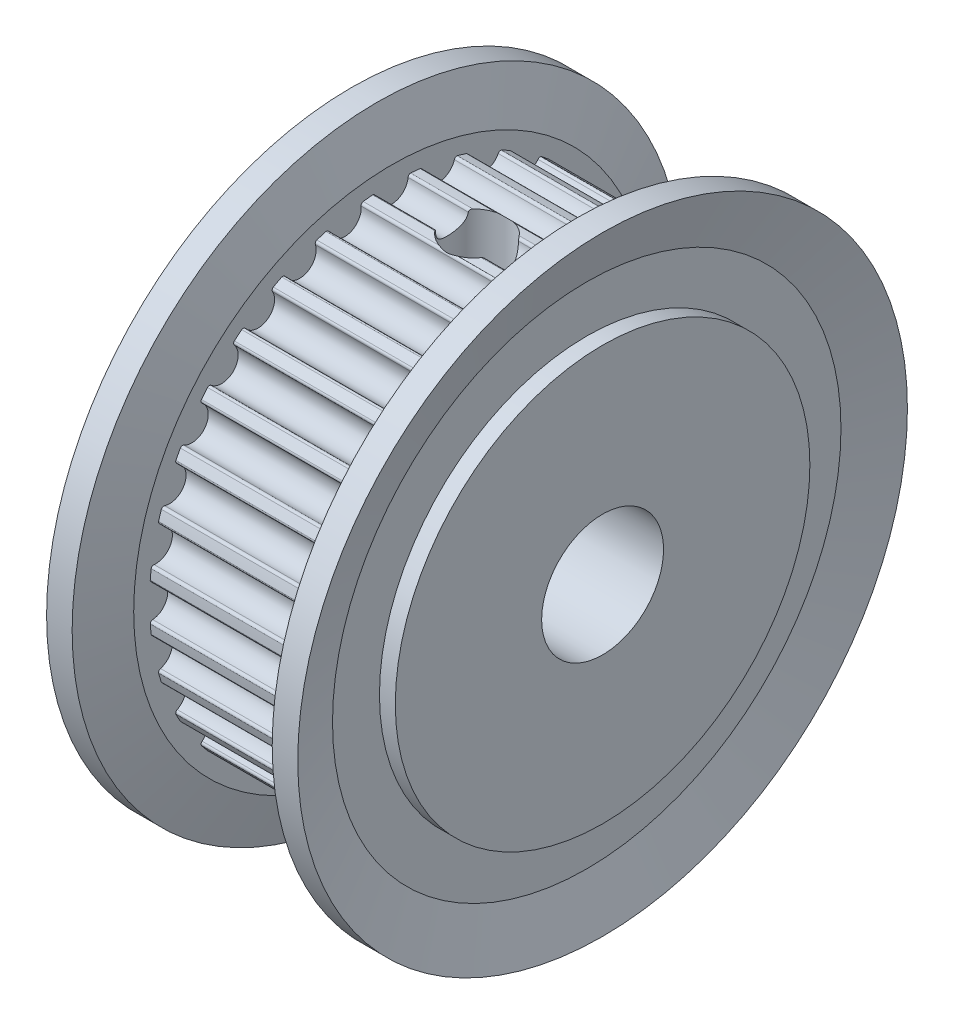
from build123d import *

# Parameters (mm, degrees)
CUT_EXTRUDE1_DEPTH       = 3.5
CUT_EXTRUDE1_DEPTH_BACK  = 3.5
CUT_EXTRUDE2_DEPTH       = 3.5
CUT_EXTRUDE2_DEPTH_BACK  = 3.5
CUT_EXTRUDE3_DEPTH       = 3.5
CUT_EXTRUDE3_DEPTH_BACK  = 3.5
CUT_EXTRUDE4_DEPTH       = 3.5
CUT_EXTRUDE4_DEPTH_BACK  = 3.5
CUT_EXTRUDE5_DEPTH       = 3.5
CUT_EXTRUDE5_DEPTH_BACK  = 3.5
CUT_EXTRUDE6_DEPTH       = 3.5
CUT_EXTRUDE6_DEPTH_BACK  = 3.5
CUT_EXTRUDE7_DEPTH       = 3.5
CUT_EXTRUDE7_DEPTH_BACK  = 3.5
CUT_EXTRUDE8_DEPTH       = 3.5
CUT_EXTRUDE8_DEPTH_BACK  = 3.5
CUT_EXTRUDE9_DEPTH       = 3.5
CUT_EXTRUDE9_DEPTH_BACK  = 3.5
CUT_EXTRUDE10_DEPTH      = 3.5
CUT_EXTRUDE10_DEPTH_BACK = 3.5
CUT_EXTRUDE11_DEPTH      = 3.5
CUT_EXTRUDE11_DEPTH_BACK = 3.5
CUT_EXTRUDE12_DEPTH      = 3.5
CUT_EXTRUDE12_DEPTH_BACK = 3.5
CUT_EXTRUDE13_DEPTH      = 3.5
CUT_EXTRUDE13_DEPTH_BACK = 3.5
CUT_EXTRUDE14_DEPTH      = 3.5
CUT_EXTRUDE14_DEPTH_BACK = 3.5
CUT_EXTRUDE15_DEPTH      = 3.5
CUT_EXTRUDE15_DEPTH_BACK = 3.5
CUT_EXTRUDE16_DEPTH      = 3.5
CUT_EXTRUDE16_DEPTH_BACK = 3.5
CUT_EXTRUDE17_DEPTH      = 3.5
CUT_EXTRUDE17_DEPTH_BACK = 3.5
CUT_EXTRUDE18_DEPTH      = 3.5
CUT_EXTRUDE18_DEPTH_BACK = 3.5
CUT_EXTRUDE19_DEPTH      = 3.5
CUT_EXTRUDE19_DEPTH_BACK = 3.5
CUT_EXTRUDE20_DEPTH      = 3.5
CUT_EXTRUDE20_DEPTH_BACK = 3.5
CUT_EXTRUDE21_DEPTH      = 3.5
CUT_EXTRUDE21_DEPTH_BACK = 3.5
CUT_EXTRUDE22_DEPTH      = 3.5
CUT_EXTRUDE22_DEPTH_BACK = 3.5
CUT_EXTRUDE23_DEPTH      = 3.5
CUT_EXTRUDE23_DEPTH_BACK = 3.5
CUT_EXTRUDE24_DEPTH      = 3.5
CUT_EXTRUDE24_DEPTH_BACK = 3.5
CUT_EXTRUDE25_DEPTH      = 3.5
CUT_EXTRUDE25_DEPTH_BACK = 3.5
CUT_EXTRUDE26_DEPTH      = 3.5
CUT_EXTRUDE26_DEPTH_BACK = 3.5
CUT_EXTRUDE27_DEPTH      = 3.5
CUT_EXTRUDE27_DEPTH_BACK = 3.5
CUT_EXTRUDE28_DEPTH      = 3.5
CUT_EXTRUDE28_DEPTH_BACK = 3.5
CUT_EXTRUDE29_DEPTH      = 3.5
CUT_EXTRUDE29_DEPTH_BACK = 3.5
CUT_EXTRUDE30_DEPTH      = 3.5
CUT_EXTRUDE30_DEPTH_BACK = 3.5
CUT_EXTRUDE31_DEPTH      = 3.5
CUT_EXTRUDE31_DEPTH_BACK = 3.5
CUT_EXTRUDE32_DEPTH      = 3.5
CUT_EXTRUDE32_DEPTH_BACK = 3.5
SKETCH36_W               = 10.3
SKETCH36_H               = 2.5
SKETCH37_W               = 1.2295
SKETCH37_H               = 9.93


with BuildPart() as part:
    # Sketch1 → Revolve1 (revolve)
    with BuildSketch(Plane.XY, mode=Mode.PRIVATE) as revolve1_sk:
        Polygon((-5.15, 0), (-5.15, 8.5), (-3.5, 8.5), (-3.5, 9.93), (3.5, 9.93), (3.5, 8.5), (5.15, 8.5), (5.15, 0), align=None)
    revolve(revolve1_sk.sketch.rotate(Axis((5.15, 0, 0), (-1, 0, 0)), 270), axis=Axis((5.15, 0, 0), (-1, 0, 0)))

    # Sketch2 → Cut-Extrude1 (cut, two sides: drawn at the far end of the back side and taken through both)
    with BuildSketch(Plane(origin=(0, 0, 0), x_dir=(0, 0, -1), z_dir=(1, 0, 0)).offset(-CUT_EXTRUDE1_DEPTH_BACK)):
        with BuildLine():
            Line((-0.950908352, 10.140512724), (-0.927279331, 9.888532197))
            Line((-0.927279331, 9.888532197), (-0.792969158, 9.89929093))
            ThreePointArc((-0.792969158, 9.89929093), (-0.711706778, 9.873169891), (-0.672449407, 9.797375816))
            ThreePointArc((-0.672449407, 9.797375816), (-2e-09, 9.181), (0.672449407, 9.797375812))
            ThreePointArc((0.672449407, 9.797375812), (0.711706777, 9.87316989), (0.792969158, 9.89929093))
            Line((0.792969158, 9.89929093), (0.927279331, 9.888532197))
            Line((0.927279331, 9.888532197), (0.950908352, 10.140512724))
            ThreePointArc((0.950908352, 10.140512724), (0, 10.185), (-0.950908352, 10.140512724))
        make_face()
    extrude(amount=CUT_EXTRUDE1_DEPTH + CUT_EXTRUDE1_DEPTH_BACK, mode=Mode.SUBTRACT)

    # Sketch3 → Cut-Extrude2 (cut, two sides: drawn at the far end of the back side and taken through both)
    with BuildSketch(Plane(origin=(0, 0, 0), x_dir=(0, 0, -1), z_dir=(1, 0, 0)).offset(-CUT_EXTRUDE2_DEPTH_BACK)):
        with BuildLine():
            Line((-2.910952807, 9.760152599), (-2.838618849, 9.5176236))
            Line((-2.838618849, 9.5176236), (-2.708988333, 9.554378222))
            ThreePointArc((-2.708988333, 9.554378222), (-2.624191426, 9.544612596), (-2.570901683, 9.477933616))
            ThreePointArc((-2.570901683, 9.477933616), (-1.791124249, 9.004589659), (-1.251844722, 9.740310354))
            ThreePointArc((-1.251844722, 9.740310354), (-1.228128363, 9.822306803), (-1.153523377, 9.863779439))
            Line((-1.153523377, 9.863779439), (-1.019695012, 9.879430047))
            Line((-1.019695012, 9.879430047), (-1.045678978, 10.131178632))
            ThreePointArc((-1.045678978, 10.131178632), (-1.98699493, 9.989298081), (-2.910952807, 9.760152599))
        make_face()
    extrude(amount=CUT_EXTRUDE2_DEPTH + CUT_EXTRUDE2_DEPTH_BACK, mode=Mode.SUBTRACT)

    # Sketch4 → Cut-Extrude3 (cut, two sides: drawn at the far end of the back side and taken through both)
    with BuildSketch(Plane(origin=(0, 0, 0), x_dir=(0, 0, -1), z_dir=(1, 0, 0)).offset(-CUT_EXTRUDE3_DEPTH_BACK)):
        with BuildLine():
            Line((-4.759130979, 9.004715283), (-4.640871837, 8.780958066))
            Line((-4.640871837, 8.780958066), (-4.520902606, 8.842296117))
            ThreePointArc((-4.520902606, 8.842296117), (-4.435829868, 8.849261191), (-4.370555649, 8.794259742))
            ThreePointArc((-4.370555649, 8.794259742), (-3.513416595, 8.482137987), (-3.12803116, 9.308930232))
            ThreePointArc((-3.12803116, 9.308930232), (-3.120767218, 9.393977974), (-3.055686656, 9.449208436))
            Line((-3.055686656, 9.449208436), (-2.927483047, 9.490666941))
            Line((-2.927483047, 9.490666941), (-3.002081451, 9.732509027))
            ThreePointArc((-3.002081451, 9.732509027), (-3.897630759, 9.409713039), (-4.759130979, 9.004715283))
        make_face()
    extrude(amount=CUT_EXTRUDE3_DEPTH + CUT_EXTRUDE3_DEPTH_BACK, mode=Mode.SUBTRACT)

    # Sketch5 → Cut-Extrude4 (cut, two sides: drawn at the far end of the back side and taken through both)
    with BuildSketch(Plane(origin=(0, 0, 0), x_dir=(0, 0, -1), z_dir=(1, 0, 0)).offset(-CUT_EXTRUDE4_DEPTH_BACK)):
        with BuildLine():
            Line((-6.424418416, 7.903231808), (-6.264778723, 7.706845238))
            Line((-6.264778723, 7.706845238), (-6.159081127, 7.790409532))
            ThreePointArc((-6.159081127, 7.790409532), (-6.077001856, 7.813837641), (-6.002251613, 7.772627398))
            ThreePointArc((-6.002251613, 7.772627398), (-5.100690311, 7.633722509), (-4.884009115, 8.519813141))
            ThreePointArc((-4.884009115, 8.519813141), (-4.893476739, 8.60464384), (-4.84042161, 8.671509651))
            Line((-4.84042161, 8.671509651), (-4.722769551, 8.737182826))
            Line((-4.722769551, 8.737182826), (-4.843115618, 8.959824558))
            ThreePointArc((-4.843115618, 8.959824558), (-5.658482823, 8.468518001), (-6.424418416, 7.903231808))
        make_face()
    extrude(amount=CUT_EXTRUDE4_DEPTH + CUT_EXTRUDE4_DEPTH_BACK, mode=Mode.SUBTRACT)

    # Sketch6 → Cut-Extrude5 (cut, two sides: drawn at the far end of the back side and taken through both)
    with BuildSketch(Plane(origin=(0, 0, 0), x_dir=(0, 0, -1), z_dir=(1, 0, 0)).offset(-CUT_EXTRUDE5_DEPTH_BACK)):
        with BuildLine():
            Line((-7.842819056, 6.498031568), (-7.647933676, 6.33656267))
            Line((-7.647933676, 6.33656267), (-7.560569614, 6.439141876))
            ThreePointArc((-7.560569614, 6.439141876), (-7.484638071, 6.478132693), (-7.403284413, 6.452297342))
            ThreePointArc((-7.403284413, 6.452297342), (-6.49194736, 6.491947357), (-6.452297339, 7.40328441))
            ThreePointArc((-6.452297339, 7.40328441), (-6.478132693, 7.484638069), (-6.439141876, 7.560569614))
            Line((-6.439141876, 7.560569614), (-6.33656267, 7.647933676))
            Line((-6.33656267, 7.647933676), (-6.498031568, 7.842819056))
            ThreePointArc((-6.498031568, 7.842819056), (-7.201882566, 7.201882566), (-7.842819056, 6.498031568))
        make_face()
    extrude(amount=CUT_EXTRUDE5_DEPTH + CUT_EXTRUDE5_DEPTH_BACK, mode=Mode.SUBTRACT)

    # Sketch7 → Cut-Extrude6 (cut, two sides: drawn at the far end of the back side and taken through both)
    with BuildSketch(Plane(origin=(0, 0, 0), x_dir=(0, 0, -1), z_dir=(1, 0, 0)).offset(-CUT_EXTRUDE6_DEPTH_BACK)):
        with BuildLine():
            Line((-8.959824558, 4.843115618), (-8.737182826, 4.722769551))
            Line((-8.737182826, 4.722769551), (-8.671509651, 4.84042161))
            ThreePointArc((-8.671509651, 4.84042161), (-8.604643842, 4.893476738), (-8.519813145, 4.884009117))
            ThreePointArc((-8.519813145, 4.884009117), (-7.633722512, 5.100690308), (-7.772627394, 6.00225161))
            ThreePointArc((-7.772627394, 6.00225161), (-7.813837641, 6.077001854), (-7.790409532, 6.159081127))
            Line((-7.790409532, 6.159081127), (-7.706845238, 6.264778723))
            Line((-7.706845238, 6.264778723), (-7.903231808, 6.424418416))
            ThreePointArc((-7.903231808, 6.424418416), (-8.468518001, 5.658482823), (-8.959824558, 4.843115618))
        make_face()
    extrude(amount=CUT_EXTRUDE6_DEPTH + CUT_EXTRUDE6_DEPTH_BACK, mode=Mode.SUBTRACT)

    # Sketch8 → Cut-Extrude7 (cut, two sides: drawn at the far end of the back side and taken through both)
    with BuildSketch(Plane(origin=(0, 0, 0), x_dir=(0, 0, -1), z_dir=(1, 0, 0)).offset(-CUT_EXTRUDE7_DEPTH_BACK)):
        with BuildLine():
            Line((-9.732509027, 3.002081451), (-9.490666941, 2.927483047))
            Line((-9.490666941, 2.927483047), (-9.449208436, 3.055686656))
            ThreePointArc((-9.449208436, 3.055686656), (-9.393977976, 3.120767217), (-9.308930236, 3.128031162))
            ThreePointArc((-9.308930236, 3.128031162), (-8.482137989, 3.513416591), (-8.794259738, 4.370555647))
            ThreePointArc((-8.794259738, 4.370555647), (-8.84926119, 4.435829866), (-8.842296117, 4.520902606))
            Line((-8.842296117, 4.520902606), (-8.780958066, 4.640871837))
            Line((-8.780958066, 4.640871837), (-9.004715283, 4.759130979))
            ThreePointArc((-9.004715283, 4.759130979), (-9.409713039, 3.897630759), (-9.732509027, 3.002081451))
        make_face()
    extrude(amount=CUT_EXTRUDE7_DEPTH + CUT_EXTRUDE7_DEPTH_BACK, mode=Mode.SUBTRACT)

    # Sketch9 → Cut-Extrude8 (cut, two sides: drawn at the far end of the back side and taken through both)
    with BuildSketch(Plane(origin=(0, 0, 0), x_dir=(0, 0, -1), z_dir=(1, 0, 0)).offset(-CUT_EXTRUDE8_DEPTH_BACK)):
        with BuildLine():
            Line((-10.131178632, 1.045678978), (-9.879430047, 1.019695012))
            Line((-9.879430047, 1.019695012), (-9.863779439, 1.153523377))
            ThreePointArc((-9.863779439, 1.153523377), (-9.822306805, 1.228128361), (-9.740310358, 1.251844723))
            ThreePointArc((-9.740310358, 1.251844723), (-9.00458966, 1.791124244), (-9.477933611, 2.570901682))
            ThreePointArc((-9.477933611, 2.570901682), (-9.544612594, 2.624191424), (-9.554378222, 2.708988333))
            Line((-9.554378222, 2.708988333), (-9.5176236, 2.838618849))
            Line((-9.5176236, 2.838618849), (-9.760152599, 2.910952807))
            ThreePointArc((-9.760152599, 2.910952807), (-9.989298081, 1.98699493), (-10.131178632, 1.045678978))
        make_face()
    extrude(amount=CUT_EXTRUDE8_DEPTH + CUT_EXTRUDE8_DEPTH_BACK, mode=Mode.SUBTRACT)

    # Sketch10 → Cut-Extrude9 (cut, two sides: drawn at the far end of the back side and taken through both)
    with BuildSketch(Plane(origin=(0, 0, 0), x_dir=(0, 0, -1), z_dir=(1, 0, 0)).offset(-CUT_EXTRUDE9_DEPTH_BACK)):
        with BuildLine():
            Line((-10.140512724, -0.950908352), (-9.888532197, -0.927279331))
            Line((-9.888532197, -0.927279331), (-9.89929093, -0.792969158))
            ThreePointArc((-9.89929093, -0.792969158), (-9.873169891, -0.711706778), (-9.797375816, -0.672449407))
            ThreePointArc((-9.797375816, -0.672449407), (-9.181, -2e-09), (-9.797375812, 0.672449407))
            ThreePointArc((-9.797375812, 0.672449407), (-9.87316989, 0.711706777), (-9.89929093, 0.792969158))
            Line((-9.89929093, 0.792969158), (-9.888532197, 0.927279331))
            Line((-9.888532197, 0.927279331), (-10.140512724, 0.950908352))
            ThreePointArc((-10.140512724, 0.950908352), (-10.185, 0), (-10.140512724, -0.950908352))
        make_face()
    extrude(amount=CUT_EXTRUDE9_DEPTH + CUT_EXTRUDE9_DEPTH_BACK, mode=Mode.SUBTRACT)

    # Sketch11 → Cut-Extrude10 (cut, two sides: drawn at the far end of the back side and taken through both)
    with BuildSketch(Plane(origin=(0, 0, 0), x_dir=(0, 0, -1), z_dir=(1, 0, 0)).offset(-CUT_EXTRUDE10_DEPTH_BACK)):
        with BuildLine():
            Line((-9.760152599, -2.910952807), (-9.5176236, -2.838618849))
            Line((-9.5176236, -2.838618849), (-9.554378222, -2.708988333))
            ThreePointArc((-9.554378222, -2.708988333), (-9.544612596, -2.624191426), (-9.477933616, -2.570901683))
            ThreePointArc((-9.477933616, -2.570901683), (-9.004589659, -1.791124249), (-9.740310354, -1.251844722))
            ThreePointArc((-9.740310354, -1.251844722), (-9.822306803, -1.228128363), (-9.863779439, -1.153523377))
            Line((-9.863779439, -1.153523377), (-9.879430047, -1.019695012))
            Line((-9.879430047, -1.019695012), (-10.131178632, -1.045678978))
            ThreePointArc((-10.131178632, -1.045678978), (-9.989298081, -1.98699493), (-9.760152599, -2.910952807))
        make_face()
    extrude(amount=CUT_EXTRUDE10_DEPTH + CUT_EXTRUDE10_DEPTH_BACK, mode=Mode.SUBTRACT)

    # Sketch12 → Cut-Extrude11 (cut, two sides: drawn at the far end of the back side and taken through both)
    with BuildSketch(Plane(origin=(0, 0, 0), x_dir=(0, 0, -1), z_dir=(1, 0, 0)).offset(-CUT_EXTRUDE11_DEPTH_BACK)):
        with BuildLine():
            Line((-9.004715283, -4.759130979), (-8.780958066, -4.640871837))
            Line((-8.780958066, -4.640871837), (-8.842296117, -4.520902606))
            ThreePointArc((-8.842296117, -4.520902606), (-8.849261191, -4.435829868), (-8.794259742, -4.370555649))
            ThreePointArc((-8.794259742, -4.370555649), (-8.482137987, -3.513416595), (-9.308930232, -3.12803116))
            ThreePointArc((-9.308930232, -3.12803116), (-9.393977974, -3.120767218), (-9.449208436, -3.055686656))
            Line((-9.449208436, -3.055686656), (-9.490666941, -2.927483047))
            Line((-9.490666941, -2.927483047), (-9.732509027, -3.002081451))
            ThreePointArc((-9.732509027, -3.002081451), (-9.409713039, -3.897630759), (-9.004715283, -4.759130979))
        make_face()
    extrude(amount=CUT_EXTRUDE11_DEPTH + CUT_EXTRUDE11_DEPTH_BACK, mode=Mode.SUBTRACT)

    # Sketch13 → Cut-Extrude12 (cut, two sides: drawn at the far end of the back side and taken through both)
    with BuildSketch(Plane(origin=(0, 0, 0), x_dir=(0, 0, -1), z_dir=(1, 0, 0)).offset(-CUT_EXTRUDE12_DEPTH_BACK)):
        with BuildLine():
            Line((-7.903231808, -6.424418416), (-7.706845238, -6.264778723))
            Line((-7.706845238, -6.264778723), (-7.790409532, -6.159081127))
            ThreePointArc((-7.790409532, -6.159081127), (-7.813837641, -6.077001856), (-7.772627398, -6.002251613))
            ThreePointArc((-7.772627398, -6.002251613), (-7.633722509, -5.100690311), (-8.519813141, -4.884009115))
            ThreePointArc((-8.519813141, -4.884009115), (-8.60464384, -4.893476739), (-8.671509651, -4.84042161))
            Line((-8.671509651, -4.84042161), (-8.737182826, -4.722769551))
            Line((-8.737182826, -4.722769551), (-8.959824558, -4.843115618))
            ThreePointArc((-8.959824558, -4.843115618), (-8.468518001, -5.658482823), (-7.903231808, -6.424418416))
        make_face()
    extrude(amount=CUT_EXTRUDE12_DEPTH + CUT_EXTRUDE12_DEPTH_BACK, mode=Mode.SUBTRACT)

    # Sketch14 → Cut-Extrude13 (cut, two sides: drawn at the far end of the back side and taken through both)
    with BuildSketch(Plane(origin=(0, 0, 0), x_dir=(0, 0, -1), z_dir=(1, 0, 0)).offset(-CUT_EXTRUDE13_DEPTH_BACK)):
        with BuildLine():
            Line((-6.498031568, -7.842819056), (-6.33656267, -7.647933676))
            Line((-6.33656267, -7.647933676), (-6.439141876, -7.560569614))
            ThreePointArc((-6.439141876, -7.560569614), (-6.478132693, -7.484638071), (-6.452297342, -7.403284413))
            ThreePointArc((-6.452297342, -7.403284413), (-6.491947357, -6.49194736), (-7.40328441, -6.452297339))
            ThreePointArc((-7.40328441, -6.452297339), (-7.484638069, -6.478132693), (-7.560569614, -6.439141876))
            Line((-7.560569614, -6.439141876), (-7.647933676, -6.33656267))
            Line((-7.647933676, -6.33656267), (-7.842819056, -6.498031568))
            ThreePointArc((-7.842819056, -6.498031568), (-7.201882566, -7.201882566), (-6.498031568, -7.842819056))
        make_face()
    extrude(amount=CUT_EXTRUDE13_DEPTH + CUT_EXTRUDE13_DEPTH_BACK, mode=Mode.SUBTRACT)

    # Sketch15 → Cut-Extrude14 (cut, two sides: drawn at the far end of the back side and taken through both)
    with BuildSketch(Plane(origin=(0, 0, 0), x_dir=(0, 0, -1), z_dir=(1, 0, 0)).offset(-CUT_EXTRUDE14_DEPTH_BACK)):
        with BuildLine():
            Line((-4.843115618, -8.959824558), (-4.722769551, -8.737182826))
            Line((-4.722769551, -8.737182826), (-4.84042161, -8.671509651))
            ThreePointArc((-4.84042161, -8.671509651), (-4.893476738, -8.604643842), (-4.884009117, -8.519813145))
            ThreePointArc((-4.884009117, -8.519813145), (-5.100690308, -7.633722512), (-6.00225161, -7.772627394))
            ThreePointArc((-6.00225161, -7.772627394), (-6.077001854, -7.813837641), (-6.159081127, -7.790409532))
            Line((-6.159081127, -7.790409532), (-6.264778723, -7.706845238))
            Line((-6.264778723, -7.706845238), (-6.424418416, -7.903231808))
            ThreePointArc((-6.424418416, -7.903231808), (-5.658482823, -8.468518001), (-4.843115618, -8.959824558))
        make_face()
    extrude(amount=CUT_EXTRUDE14_DEPTH + CUT_EXTRUDE14_DEPTH_BACK, mode=Mode.SUBTRACT)

    # Sketch16 → Cut-Extrude15 (cut, two sides: drawn at the far end of the back side and taken through both)
    with BuildSketch(Plane(origin=(0, 0, 0), x_dir=(0, 0, -1), z_dir=(1, 0, 0)).offset(-CUT_EXTRUDE15_DEPTH_BACK)):
        with BuildLine():
            Line((-3.002081451, -9.732509027), (-2.927483047, -9.490666941))
            Line((-2.927483047, -9.490666941), (-3.055686656, -9.449208436))
            ThreePointArc((-3.055686656, -9.449208436), (-3.120767217, -9.393977976), (-3.128031162, -9.308930236))
            ThreePointArc((-3.128031162, -9.308930236), (-3.513416591, -8.482137989), (-4.370555647, -8.794259738))
            ThreePointArc((-4.370555647, -8.794259738), (-4.435829866, -8.84926119), (-4.520902606, -8.842296117))
            Line((-4.520902606, -8.842296117), (-4.640871837, -8.780958066))
            Line((-4.640871837, -8.780958066), (-4.759130979, -9.004715283))
            ThreePointArc((-4.759130979, -9.004715283), (-3.897630759, -9.409713039), (-3.002081451, -9.732509027))
        make_face()
    extrude(amount=CUT_EXTRUDE15_DEPTH + CUT_EXTRUDE15_DEPTH_BACK, mode=Mode.SUBTRACT)

    # Sketch17 → Cut-Extrude16 (cut, two sides: drawn at the far end of the back side and taken through both)
    with BuildSketch(Plane(origin=(0, 0, 0), x_dir=(0, 0, -1), z_dir=(1, 0, 0)).offset(-CUT_EXTRUDE16_DEPTH_BACK)):
        with BuildLine():
            Line((-1.045678978, -10.131178632), (-1.019695012, -9.879430047))
            Line((-1.019695012, -9.879430047), (-1.153523377, -9.863779439))
            ThreePointArc((-1.153523377, -9.863779439), (-1.228128361, -9.822306805), (-1.251844723, -9.740310358))
            ThreePointArc((-1.251844723, -9.740310358), (-1.791124244, -9.00458966), (-2.570901682, -9.477933611))
            ThreePointArc((-2.570901682, -9.477933611), (-2.624191424, -9.544612594), (-2.708988333, -9.554378222))
            Line((-2.708988333, -9.554378222), (-2.838618849, -9.5176236))
            Line((-2.838618849, -9.5176236), (-2.910952807, -9.760152599))
            ThreePointArc((-2.910952807, -9.760152599), (-1.98699493, -9.989298081), (-1.045678978, -10.131178632))
        make_face()
    extrude(amount=CUT_EXTRUDE16_DEPTH + CUT_EXTRUDE16_DEPTH_BACK, mode=Mode.SUBTRACT)

    # Sketch18 → Cut-Extrude17 (cut, two sides: drawn at the far end of the back side and taken through both)
    with BuildSketch(Plane(origin=(0, 0, 0), x_dir=(0, 0, -1), z_dir=(1, 0, 0)).offset(-CUT_EXTRUDE17_DEPTH_BACK)):
        with BuildLine():
            Line((0.950908352, -10.140512724), (0.927279331, -9.888532197))
            Line((0.927279331, -9.888532197), (0.792969158, -9.89929093))
            ThreePointArc((0.792969158, -9.89929093), (0.711706778, -9.873169891), (0.672449407, -9.797375816))
            ThreePointArc((0.672449407, -9.797375816), (2e-09, -9.181), (-0.672449407, -9.797375812))
            ThreePointArc((-0.672449407, -9.797375812), (-0.711706777, -9.87316989), (-0.792969158, -9.89929093))
            Line((-0.792969158, -9.89929093), (-0.927279331, -9.888532197))
            Line((-0.927279331, -9.888532197), (-0.950908352, -10.140512724))
            ThreePointArc((-0.950908352, -10.140512724), (0, -10.185), (0.950908352, -10.140512724))
        make_face()
    extrude(amount=CUT_EXTRUDE17_DEPTH + CUT_EXTRUDE17_DEPTH_BACK, mode=Mode.SUBTRACT)

    # Sketch19 → Cut-Extrude18 (cut, two sides: drawn at the far end of the back side and taken through both)
    with BuildSketch(Plane(origin=(0, 0, 0), x_dir=(0, 0, -1), z_dir=(1, 0, 0)).offset(-CUT_EXTRUDE18_DEPTH_BACK)):
        with BuildLine():
            Line((2.910952807, -9.760152599), (2.838618849, -9.5176236))
            Line((2.838618849, -9.5176236), (2.708988333, -9.554378222))
            ThreePointArc((2.708988333, -9.554378222), (2.624191426, -9.544612596), (2.570901683, -9.477933616))
            ThreePointArc((2.570901683, -9.477933616), (1.791124249, -9.004589659), (1.251844722, -9.740310354))
            ThreePointArc((1.251844722, -9.740310354), (1.228128363, -9.822306803), (1.153523377, -9.863779439))
            Line((1.153523377, -9.863779439), (1.019695012, -9.879430047))
            Line((1.019695012, -9.879430047), (1.045678978, -10.131178632))
            ThreePointArc((1.045678978, -10.131178632), (1.98699493, -9.989298081), (2.910952807, -9.760152599))
        make_face()
    extrude(amount=CUT_EXTRUDE18_DEPTH + CUT_EXTRUDE18_DEPTH_BACK, mode=Mode.SUBTRACT)

    # Sketch20 → Cut-Extrude19 (cut, two sides: drawn at the far end of the back side and taken through both)
    with BuildSketch(Plane(origin=(0, 0, 0), x_dir=(0, 0, -1), z_dir=(1, 0, 0)).offset(-CUT_EXTRUDE19_DEPTH_BACK)):
        with BuildLine():
            Line((4.759130979, -9.004715283), (4.640871837, -8.780958066))
            Line((4.640871837, -8.780958066), (4.520902606, -8.842296117))
            ThreePointArc((4.520902606, -8.842296117), (4.435829868, -8.849261191), (4.370555649, -8.794259742))
            ThreePointArc((4.370555649, -8.794259742), (3.513416595, -8.482137987), (3.12803116, -9.308930232))
            ThreePointArc((3.12803116, -9.308930232), (3.120767218, -9.393977974), (3.055686656, -9.449208436))
            Line((3.055686656, -9.449208436), (2.927483047, -9.490666941))
            Line((2.927483047, -9.490666941), (3.002081451, -9.732509027))
            ThreePointArc((3.002081451, -9.732509027), (3.897630759, -9.409713039), (4.759130979, -9.004715283))
        make_face()
    extrude(amount=CUT_EXTRUDE19_DEPTH + CUT_EXTRUDE19_DEPTH_BACK, mode=Mode.SUBTRACT)

    # Sketch21 → Cut-Extrude20 (cut, two sides: drawn at the far end of the back side and taken through both)
    with BuildSketch(Plane(origin=(0, 0, 0), x_dir=(0, 0, -1), z_dir=(1, 0, 0)).offset(-CUT_EXTRUDE20_DEPTH_BACK)):
        with BuildLine():
            Line((6.424418416, -7.903231808), (6.264778723, -7.706845238))
            Line((6.264778723, -7.706845238), (6.159081127, -7.790409532))
            ThreePointArc((6.159081127, -7.790409532), (6.077001856, -7.813837641), (6.002251613, -7.772627398))
            ThreePointArc((6.002251613, -7.772627398), (5.100690311, -7.633722509), (4.884009115, -8.519813141))
            ThreePointArc((4.884009115, -8.519813141), (4.893476739, -8.60464384), (4.84042161, -8.671509651))
            Line((4.84042161, -8.671509651), (4.722769551, -8.737182826))
            Line((4.722769551, -8.737182826), (4.843115618, -8.959824558))
            ThreePointArc((4.843115618, -8.959824558), (5.658482823, -8.468518001), (6.424418416, -7.903231808))
        make_face()
    extrude(amount=CUT_EXTRUDE20_DEPTH + CUT_EXTRUDE20_DEPTH_BACK, mode=Mode.SUBTRACT)

    # Sketch22 → Cut-Extrude21 (cut, two sides: drawn at the far end of the back side and taken through both)
    with BuildSketch(Plane(origin=(0, 0, 0), x_dir=(0, 0, -1), z_dir=(1, 0, 0)).offset(-CUT_EXTRUDE21_DEPTH_BACK)):
        with BuildLine():
            Line((7.842819056, -6.498031568), (7.647933676, -6.33656267))
            Line((7.647933676, -6.33656267), (7.560569614, -6.439141876))
            ThreePointArc((7.560569614, -6.439141876), (7.484638071, -6.478132693), (7.403284413, -6.452297342))
            ThreePointArc((7.403284413, -6.452297342), (6.49194736, -6.491947357), (6.452297339, -7.40328441))
            ThreePointArc((6.452297339, -7.40328441), (6.478132693, -7.484638069), (6.439141876, -7.560569614))
            Line((6.439141876, -7.560569614), (6.33656267, -7.647933676))
            Line((6.33656267, -7.647933676), (6.498031568, -7.842819056))
            ThreePointArc((6.498031568, -7.842819056), (7.201882566, -7.201882566), (7.842819056, -6.498031568))
        make_face()
    extrude(amount=CUT_EXTRUDE21_DEPTH + CUT_EXTRUDE21_DEPTH_BACK, mode=Mode.SUBTRACT)

    # Sketch23 → Cut-Extrude22 (cut, two sides: drawn at the far end of the back side and taken through both)
    with BuildSketch(Plane(origin=(0, 0, 0), x_dir=(0, 0, -1), z_dir=(1, 0, 0)).offset(-CUT_EXTRUDE22_DEPTH_BACK)):
        with BuildLine():
            Line((8.959824558, -4.843115618), (8.737182826, -4.722769551))
            Line((8.737182826, -4.722769551), (8.671509651, -4.84042161))
            ThreePointArc((8.671509651, -4.84042161), (8.604643842, -4.893476738), (8.519813145, -4.884009117))
            ThreePointArc((8.519813145, -4.884009117), (7.633722512, -5.100690308), (7.772627394, -6.00225161))
            ThreePointArc((7.772627394, -6.00225161), (7.813837641, -6.077001854), (7.790409532, -6.159081127))
            Line((7.790409532, -6.159081127), (7.706845238, -6.264778723))
            Line((7.706845238, -6.264778723), (7.903231808, -6.424418416))
            ThreePointArc((7.903231808, -6.424418416), (8.468518001, -5.658482823), (8.959824558, -4.843115618))
        make_face()
    extrude(amount=CUT_EXTRUDE22_DEPTH + CUT_EXTRUDE22_DEPTH_BACK, mode=Mode.SUBTRACT)

    # Sketch24 → Cut-Extrude23 (cut, two sides: drawn at the far end of the back side and taken through both)
    with BuildSketch(Plane(origin=(0, 0, 0), x_dir=(0, 0, -1), z_dir=(1, 0, 0)).offset(-CUT_EXTRUDE23_DEPTH_BACK)):
        with BuildLine():
            Line((9.732509027, -3.002081451), (9.490666941, -2.927483047))
            Line((9.490666941, -2.927483047), (9.449208436, -3.055686656))
            ThreePointArc((9.449208436, -3.055686656), (9.393977976, -3.120767217), (9.308930236, -3.128031162))
            ThreePointArc((9.308930236, -3.128031162), (8.482137989, -3.513416591), (8.794259738, -4.370555647))
            ThreePointArc((8.794259738, -4.370555647), (8.84926119, -4.435829866), (8.842296117, -4.520902606))
            Line((8.842296117, -4.520902606), (8.780958066, -4.640871837))
            Line((8.780958066, -4.640871837), (9.004715283, -4.759130979))
            ThreePointArc((9.004715283, -4.759130979), (9.409713039, -3.897630759), (9.732509027, -3.002081451))
        make_face()
    extrude(amount=CUT_EXTRUDE23_DEPTH + CUT_EXTRUDE23_DEPTH_BACK, mode=Mode.SUBTRACT)

    # Sketch25 → Cut-Extrude24 (cut, two sides: drawn at the far end of the back side and taken through both)
    with BuildSketch(Plane(origin=(0, 0, 0), x_dir=(0, 0, -1), z_dir=(1, 0, 0)).offset(-CUT_EXTRUDE24_DEPTH_BACK)):
        with BuildLine():
            Line((10.131178632, -1.045678978), (9.879430047, -1.019695012))
            Line((9.879430047, -1.019695012), (9.863779439, -1.153523377))
            ThreePointArc((9.863779439, -1.153523377), (9.822306805, -1.228128361), (9.740310358, -1.251844723))
            ThreePointArc((9.740310358, -1.251844723), (9.00458966, -1.791124244), (9.477933611, -2.570901682))
            ThreePointArc((9.477933611, -2.570901682), (9.544612594, -2.624191424), (9.554378222, -2.708988333))
            Line((9.554378222, -2.708988333), (9.5176236, -2.838618849))
            Line((9.5176236, -2.838618849), (9.760152599, -2.910952807))
            ThreePointArc((9.760152599, -2.910952807), (9.989298081, -1.98699493), (10.131178632, -1.045678978))
        make_face()
    extrude(amount=CUT_EXTRUDE24_DEPTH + CUT_EXTRUDE24_DEPTH_BACK, mode=Mode.SUBTRACT)

    # Sketch26 → Cut-Extrude25 (cut, two sides: drawn at the far end of the back side and taken through both)
    with BuildSketch(Plane(origin=(0, 0, 0), x_dir=(0, 0, -1), z_dir=(1, 0, 0)).offset(-CUT_EXTRUDE25_DEPTH_BACK)):
        with BuildLine():
            Line((10.140512724, 0.950908352), (9.888532197, 0.927279331))
            Line((9.888532197, 0.927279331), (9.89929093, 0.792969158))
            ThreePointArc((9.89929093, 0.792969158), (9.873169891, 0.711706778), (9.797375816, 0.672449407))
            ThreePointArc((9.797375816, 0.672449407), (9.181, 2e-09), (9.797375812, -0.672449407))
            ThreePointArc((9.797375812, -0.672449407), (9.87316989, -0.711706777), (9.89929093, -0.792969158))
            Line((9.89929093, -0.792969158), (9.888532197, -0.927279331))
            Line((9.888532197, -0.927279331), (10.140512724, -0.950908352))
            ThreePointArc((10.140512724, -0.950908352), (10.185, 0), (10.140512724, 0.950908352))
        make_face()
    extrude(amount=CUT_EXTRUDE25_DEPTH + CUT_EXTRUDE25_DEPTH_BACK, mode=Mode.SUBTRACT)

    # Sketch27 → Cut-Extrude26 (cut, two sides: drawn at the far end of the back side and taken through both)
    with BuildSketch(Plane(origin=(0, 0, 0), x_dir=(0, 0, -1), z_dir=(1, 0, 0)).offset(-CUT_EXTRUDE26_DEPTH_BACK)):
        with BuildLine():
            Line((9.760152599, 2.910952807), (9.5176236, 2.838618849))
            Line((9.5176236, 2.838618849), (9.554378222, 2.708988333))
            ThreePointArc((9.554378222, 2.708988333), (9.544612596, 2.624191426), (9.477933616, 2.570901683))
            ThreePointArc((9.477933616, 2.570901683), (9.004589659, 1.791124249), (9.740310354, 1.251844722))
            ThreePointArc((9.740310354, 1.251844722), (9.822306803, 1.228128363), (9.863779439, 1.153523377))
            Line((9.863779439, 1.153523377), (9.879430047, 1.019695012))
            Line((9.879430047, 1.019695012), (10.131178632, 1.045678978))
            ThreePointArc((10.131178632, 1.045678978), (9.989298081, 1.98699493), (9.760152599, 2.910952807))
        make_face()
    extrude(amount=CUT_EXTRUDE26_DEPTH + CUT_EXTRUDE26_DEPTH_BACK, mode=Mode.SUBTRACT)

    # Sketch28 → Cut-Extrude27 (cut, two sides: drawn at the far end of the back side and taken through both)
    with BuildSketch(Plane(origin=(0, 0, 0), x_dir=(0, 0, -1), z_dir=(1, 0, 0)).offset(-CUT_EXTRUDE27_DEPTH_BACK)):
        with BuildLine():
            Line((9.004715283, 4.759130979), (8.780958066, 4.640871837))
            Line((8.780958066, 4.640871837), (8.842296117, 4.520902606))
            ThreePointArc((8.842296117, 4.520902606), (8.849261191, 4.435829868), (8.794259742, 4.370555649))
            ThreePointArc((8.794259742, 4.370555649), (8.482137987, 3.513416595), (9.308930232, 3.12803116))
            ThreePointArc((9.308930232, 3.12803116), (9.393977974, 3.120767218), (9.449208436, 3.055686656))
            Line((9.449208436, 3.055686656), (9.490666941, 2.927483047))
            Line((9.490666941, 2.927483047), (9.732509027, 3.002081451))
            ThreePointArc((9.732509027, 3.002081451), (9.409713039, 3.897630759), (9.004715283, 4.759130979))
        make_face()
    extrude(amount=CUT_EXTRUDE27_DEPTH + CUT_EXTRUDE27_DEPTH_BACK, mode=Mode.SUBTRACT)

    # Sketch29 → Cut-Extrude28 (cut, two sides: drawn at the far end of the back side and taken through both)
    with BuildSketch(Plane(origin=(0, 0, 0), x_dir=(0, 0, -1), z_dir=(1, 0, 0)).offset(-CUT_EXTRUDE28_DEPTH_BACK)):
        with BuildLine():
            Line((7.903231808, 6.424418416), (7.706845238, 6.264778723))
            Line((7.706845238, 6.264778723), (7.790409532, 6.159081127))
            ThreePointArc((7.790409532, 6.159081127), (7.813837641, 6.077001856), (7.772627398, 6.002251613))
            ThreePointArc((7.772627398, 6.002251613), (7.633722509, 5.100690311), (8.519813141, 4.884009115))
            ThreePointArc((8.519813141, 4.884009115), (8.60464384, 4.893476739), (8.671509651, 4.84042161))
            Line((8.671509651, 4.84042161), (8.737182826, 4.722769551))
            Line((8.737182826, 4.722769551), (8.959824558, 4.843115618))
            ThreePointArc((8.959824558, 4.843115618), (8.468518001, 5.658482823), (7.903231808, 6.424418416))
        make_face()
    extrude(amount=CUT_EXTRUDE28_DEPTH + CUT_EXTRUDE28_DEPTH_BACK, mode=Mode.SUBTRACT)

    # Sketch30 → Cut-Extrude29 (cut, two sides: drawn at the far end of the back side and taken through both)
    with BuildSketch(Plane(origin=(0, 0, 0), x_dir=(0, 0, -1), z_dir=(1, 0, 0)).offset(-CUT_EXTRUDE29_DEPTH_BACK)):
        with BuildLine():
            Line((6.498031568, 7.842819056), (6.33656267, 7.647933676))
            Line((6.33656267, 7.647933676), (6.439141876, 7.560569614))
            ThreePointArc((6.439141876, 7.560569614), (6.478132693, 7.484638071), (6.452297342, 7.403284413))
            ThreePointArc((6.452297342, 7.403284413), (6.491947357, 6.49194736), (7.40328441, 6.452297339))
            ThreePointArc((7.40328441, 6.452297339), (7.484638069, 6.478132693), (7.560569614, 6.439141876))
            Line((7.560569614, 6.439141876), (7.647933676, 6.33656267))
            Line((7.647933676, 6.33656267), (7.842819056, 6.498031568))
            ThreePointArc((7.842819056, 6.498031568), (7.201882566, 7.201882566), (6.498031568, 7.842819056))
        make_face()
    extrude(amount=CUT_EXTRUDE29_DEPTH + CUT_EXTRUDE29_DEPTH_BACK, mode=Mode.SUBTRACT)

    # Sketch31 → Cut-Extrude30 (cut, two sides: drawn at the far end of the back side and taken through both)
    with BuildSketch(Plane(origin=(0, 0, 0), x_dir=(0, 0, -1), z_dir=(1, 0, 0)).offset(-CUT_EXTRUDE30_DEPTH_BACK)):
        with BuildLine():
            Line((4.843115618, 8.959824558), (4.722769551, 8.737182826))
            Line((4.722769551, 8.737182826), (4.84042161, 8.671509651))
            ThreePointArc((4.84042161, 8.671509651), (4.893476738, 8.604643842), (4.884009117, 8.519813145))
            ThreePointArc((4.884009117, 8.519813145), (5.100690308, 7.633722512), (6.00225161, 7.772627394))
            ThreePointArc((6.00225161, 7.772627394), (6.077001854, 7.813837641), (6.159081127, 7.790409532))
            Line((6.159081127, 7.790409532), (6.264778723, 7.706845238))
            Line((6.264778723, 7.706845238), (6.424418416, 7.903231808))
            ThreePointArc((6.424418416, 7.903231808), (5.658482823, 8.468518001), (4.843115618, 8.959824558))
        make_face()
    extrude(amount=CUT_EXTRUDE30_DEPTH + CUT_EXTRUDE30_DEPTH_BACK, mode=Mode.SUBTRACT)

    # Sketch32 → Cut-Extrude31 (cut, two sides: drawn at the far end of the back side and taken through both)
    with BuildSketch(Plane(origin=(0, 0, 0), x_dir=(0, 0, -1), z_dir=(1, 0, 0)).offset(-CUT_EXTRUDE31_DEPTH_BACK)):
        with BuildLine():
            Line((3.002081451, 9.732509027), (2.927483047, 9.490666941))
            Line((2.927483047, 9.490666941), (3.055686656, 9.449208436))
            ThreePointArc((3.055686656, 9.449208436), (3.120767217, 9.393977976), (3.128031162, 9.308930236))
            ThreePointArc((3.128031162, 9.308930236), (3.513416591, 8.482137989), (4.370555647, 8.794259738))
            ThreePointArc((4.370555647, 8.794259738), (4.435829866, 8.84926119), (4.520902606, 8.842296117))
            Line((4.520902606, 8.842296117), (4.640871837, 8.780958066))
            Line((4.640871837, 8.780958066), (4.759130979, 9.004715283))
            ThreePointArc((4.759130979, 9.004715283), (3.897630759, 9.409713039), (3.002081451, 9.732509027))
        make_face()
    extrude(amount=CUT_EXTRUDE31_DEPTH + CUT_EXTRUDE31_DEPTH_BACK, mode=Mode.SUBTRACT)

    # Sketch33 → Cut-Extrude32 (cut, two sides: drawn at the far end of the back side and taken through both)
    with BuildSketch(Plane(origin=(0, 0, 0), x_dir=(0, 0, -1), z_dir=(1, 0, 0)).offset(-CUT_EXTRUDE32_DEPTH_BACK)):
        with BuildLine():
            Line((1.045678978, 10.131178632), (1.019695012, 9.879430047))
            Line((1.019695012, 9.879430047), (1.153523377, 9.863779439))
            ThreePointArc((1.153523377, 9.863779439), (1.228128361, 9.822306805), (1.251844723, 9.740310358))
            ThreePointArc((1.251844723, 9.740310358), (1.791124244, 9.00458966), (2.570901682, 9.477933611))
            ThreePointArc((2.570901682, 9.477933611), (2.624191424, 9.544612594), (2.708988333, 9.554378222))
            Line((2.708988333, 9.554378222), (2.838618849, 9.5176236))
            Line((2.838618849, 9.5176236), (2.910952807, 9.760152599))
            ThreePointArc((2.910952807, 9.760152599), (1.98699493, 9.989298081), (1.045678978, 10.131178632))
        make_face()
    extrude(amount=CUT_EXTRUDE32_DEPTH + CUT_EXTRUDE32_DEPTH_BACK, mode=Mode.SUBTRACT)

    # Sketch34 → Revolve2 (revolve)
    with BuildSketch(Plane.XY, mode=Mode.PRIVATE) as revolve2_sk:
        Polygon((3.5, 8.5), (4.5, 8.5), (4.5, 10.425), (5.15, 12.5), (4.102084235, 12.5), (3.5, 10.577961864), align=None)
    revolve(revolve2_sk.sketch.rotate(Axis((50, 0, 0), (-1, 0, 0)), 270), axis=Axis((50, 0, 0), (-1, 0, 0)))

    # Sketch35 → Revolve3 (revolve)
    with BuildSketch(Plane.XY, mode=Mode.PRIVATE) as revolve3_sk:
        Polygon((-5.15, 12.5), (-4.5, 10.425), (-4.5, 8.5), (-3.5, 8.5), (-3.5, 10.577961864), (-4.102084235, 12.5), align=None)
    revolve(revolve3_sk.sketch.rotate(Axis((50, 0, 0), (-1, 0, 0)), 270), axis=Axis((50, 0, 0), (-1, 0, 0)))

    # Sketch36 → Cut-Revolve1 (revolve, cut)
    with BuildSketch(Plane.XY, mode=Mode.PRIVATE) as cut_revolve1_sk:
        with Locations((0, 1.25)):
            Rectangle(SKETCH36_W, SKETCH36_H)
    revolve(cut_revolve1_sk.sketch.rotate(Axis((5.15, 0, 0), (-1, 0, 0)), 270), axis=Axis((5.15, 0, 0), (-1, 0, 0)), mode=Mode.SUBTRACT)

    # Sketch37 → Cut-Revolve2 (revolve, cut)
    with BuildSketch(Plane(origin=(0, 0, 0), x_dir=(0, 0, -1), z_dir=(1, 0, 0)), mode=Mode.PRIVATE) as cut_revolve2_sk:
        with Locations((0.61475, 4.965)):
            Rectangle(SKETCH37_W, SKETCH37_H)
    revolve(cut_revolve2_sk.sketch.rotate(Axis((0, 0, 0), (0, 1, 0)), 180), axis=Axis((0, 0, 0), (0, 1, 0)), mode=Mode.SUBTRACT)

    # Sketch38 → Cut-Revolve3 (revolve, cut)
    with BuildSketch(Plane(origin=(0, 0, 0), x_dir=(0, 0, -1), z_dir=(1, 0, 0)), mode=Mode.PRIVATE) as cut_revolve3_sk:
        Polygon((8.25649325, -5.516812414), (7.573419649, -6.539104302), (-0.683073601, -1.022291888), (0, 0), align=None)
    revolve(cut_revolve3_sk.sketch.rotate(Axis((0, 0, 0), (0, -0.5555702330195976, -0.8314696123025485)), 180), axis=Axis((0, 0, 0), (0, -0.5555702330195976, -0.8314696123025485)), mode=Mode.SUBTRACT)


solid = part.part
